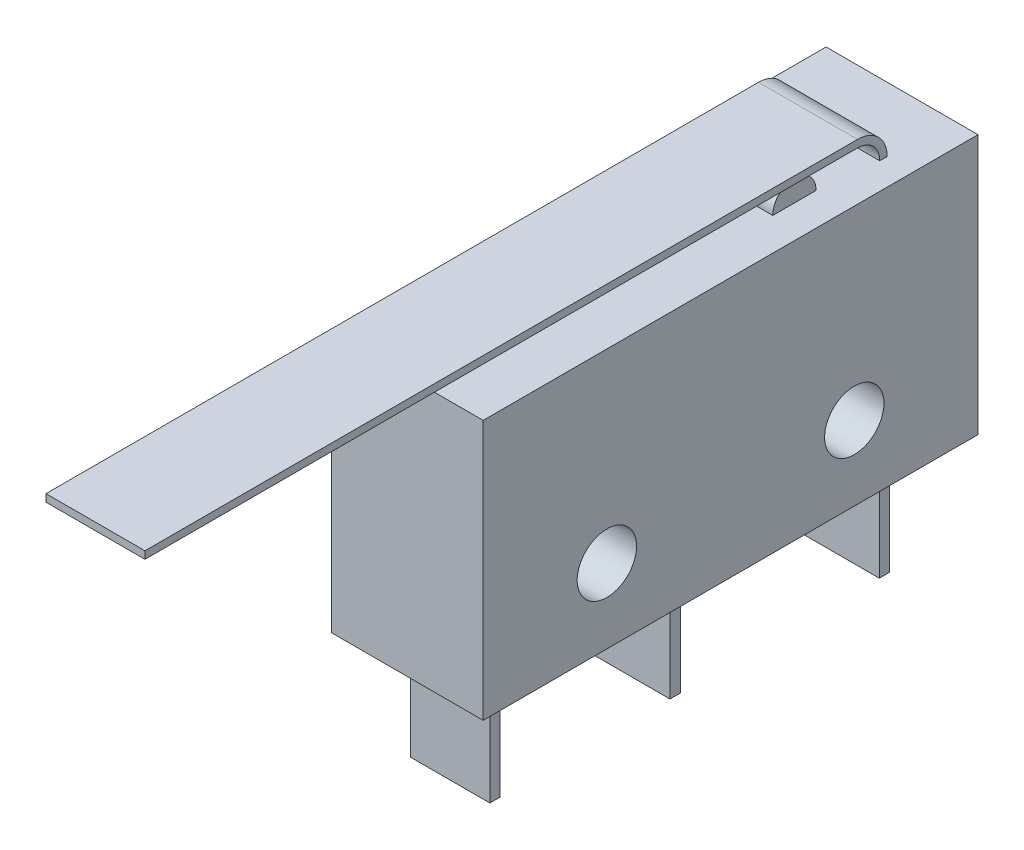
from build123d import *

# Parameters (mm, degrees)
SKETCH1_W           = 20
SKETCH1_H           = 10.5
SKETCH1_R           = 1.2
BOSS_EXTRUDE1_DEPTH = 6.14
BOSS_EXTRUDE2_DEPTH = 2
BOSS_EXTRUDE5_DEPTH = 1.75
SKETCH4_W           = 0.42
SKETCH4_H           = 4.5
BOSS_EXTRUDE6_DEPTH = 1.6


with BuildPart() as part:
    # Sketch1 → Boss-Extrude1 (new body)
    with BuildSketch(Plane(origin=(0, 0, 0), x_dir=(0, 0, -1), z_dir=(1, 0, 0))):
        with Locations((10, -5.25)):
            Rectangle(SKETCH1_W, SKETCH1_H)
        with Locations((5, -7.5)):
            Circle(SKETCH1_R, mode=Mode.SUBTRACT)
        with Locations((15, -7.5)):
            Circle(SKETCH1_R, mode=Mode.SUBTRACT)
    extrude(amount=BOSS_EXTRUDE1_DEPTH)

    # Sketch2 → Boss-Extrude2 (add, symmetric)
    with BuildSketch(Plane(origin=(3.07, 0, 0), x_dir=(0, 0, -1), z_dir=(1, 0, 0))):
        with BuildLine():
            Line((16.2, 0.9), (-12.6, 0.9))
            Line((-12.6, 0.9), (-12.6, 1.2))
            Line((-12.6, 1.2), (16.2, 1.2))
            ThreePointArc((16.2, 1.2), (17.048528137, 0.848528137), (17.4, 0))
            Line((17.4, 0), (17.1, 0))
            ThreePointArc((17.1, 0), (16.836396103, 0.636396103), (16.2, 0.9))
        make_face()
    extrude(amount=BOSS_EXTRUDE2_DEPTH, both=True)

    # Sketch3 → Boss-Extrude5 (add, symmetric)
    with BuildSketch(Plane(origin=(3.07, 0, 0), x_dir=(0, 0, -1), z_dir=(1, 0, 0))):
        with BuildLine():
            Line((13.025, 0), (14.775, 0))
            ThreePointArc((14.775, 0), (13.9, 0.875), (13.025, 0))
        make_face()
    extrude(amount=BOSS_EXTRUDE5_DEPTH, both=True)

    # Sketch4 → Boss-Extrude6 (add, symmetric)
    with BuildSketch(Plane(origin=(3.07, 0, 0), x_dir=(0, 0, -1), z_dir=(1, 0, 0))):
        with Locations((1.95, -12.75)):
            Rectangle(SKETCH4_W, SKETCH4_H)
        with Locations((9.23, -12.75)):
            Rectangle(SKETCH4_W, SKETCH4_H)
        with Locations((17.69, -12.75)):
            Rectangle(SKETCH4_W, SKETCH4_H)
    extrude(amount=BOSS_EXTRUDE6_DEPTH, both=True)


solid = part.part
